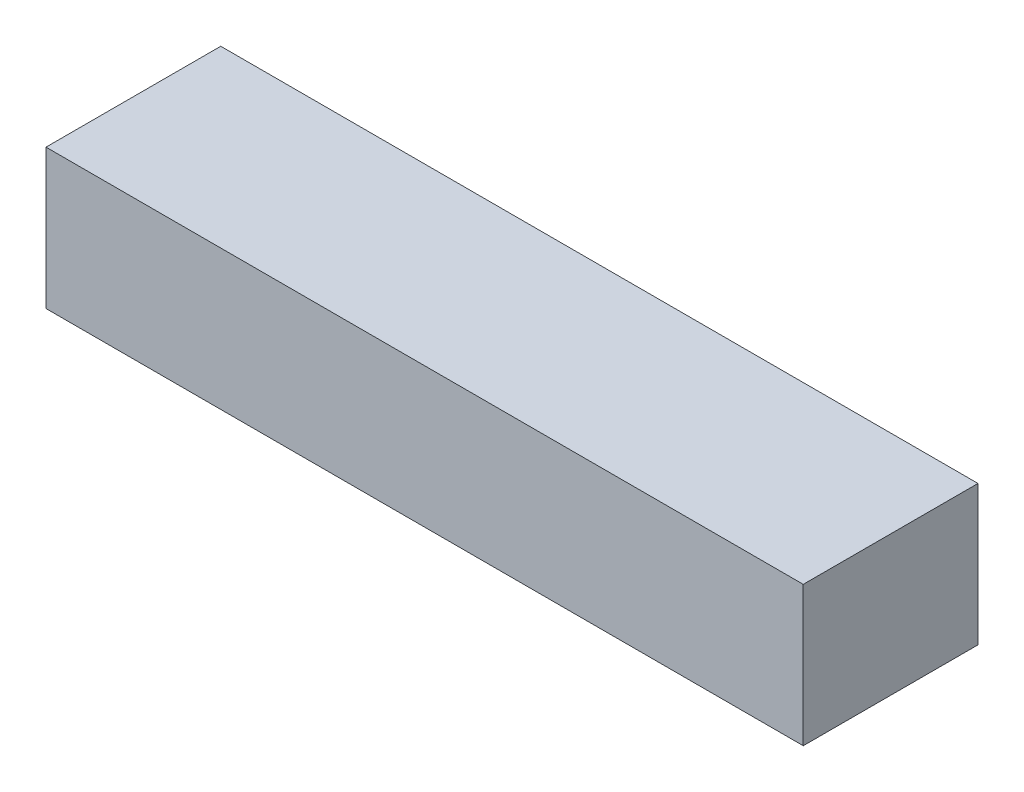
from build123d import *

# Parameters (mm, degrees)
DET2_PLC_DILIMI_1_START = -770
SKETCH1_W               = 130
SKETCH1_H               = 24
DET2_PLC_DILIMI_1_DEPTH = 30


with BuildPart() as part:
    # Sketch1 → DET2_PLC_dilimi_1 (new body)
    with BuildSketch(Plane.XY.offset(DET2_PLC_DILIMI_1_START)):
        with Locations((1143, 1636)):
            Rectangle(SKETCH1_W, SKETCH1_H)
    extrude(amount=-DET2_PLC_DILIMI_1_DEPTH)


solid = part.part
